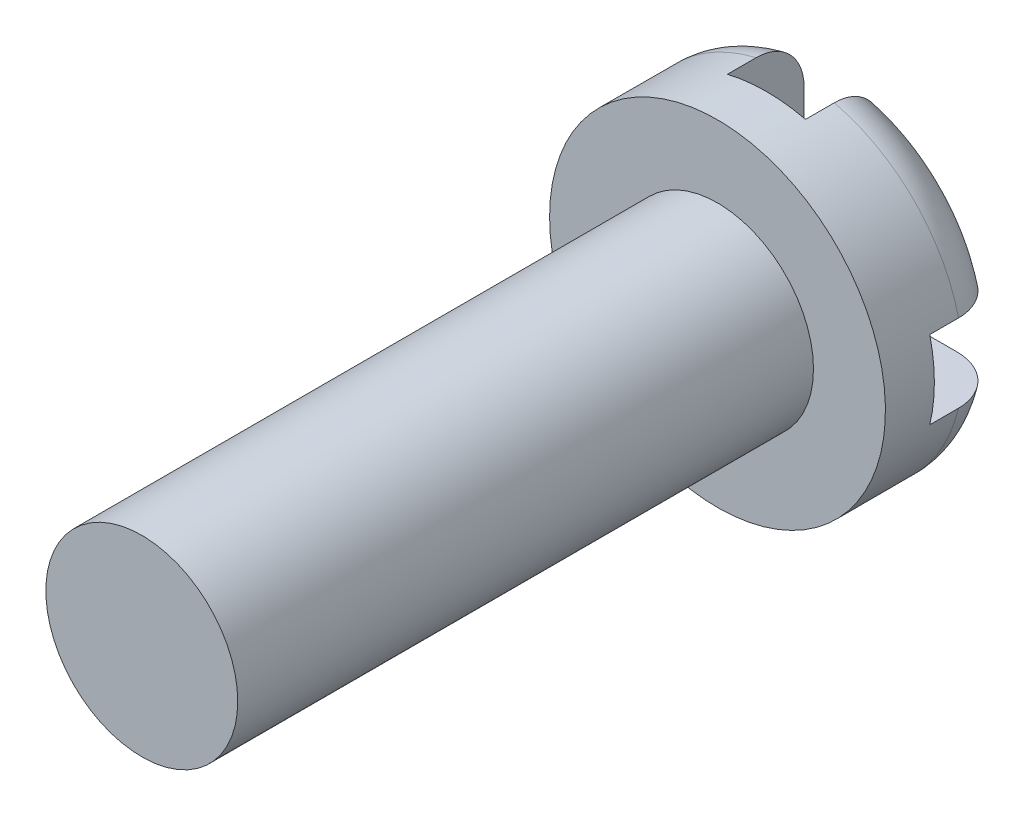
from build123d import *

# Parameters (mm, degrees)
SKETCH_1_R          = 1
EXTRUDE_1_DEPTH     = 6
SKETCH_2_R          = 1.75
EXTRUDE_2_DEPTH     = 1.31
FILLET_1_R          = 0.5
CUT_EXTRUDE_1_DEPTH = 0.8


with BuildPart() as part:
    # 草图1 → 凸台-拉伸1 (new body)
    with BuildSketch(Plane.XY):
        Circle(SKETCH_1_R)
    extrude(amount=EXTRUDE_1_DEPTH)

    # 草图2 → 凸台-拉伸2 (add)
    with BuildSketch(Plane(origin=(0, 0, 0), x_dir=(-1, 0, 0), z_dir=(0, 0, -1))):
        Circle(SKETCH_2_R)
    extrude(amount=EXTRUDE_2_DEPTH)

    # 圆角1
    fillet_1_edges = [part.edges().sort_by_distance(p)[0] for p in [
        (1.75, 0, -1.31),
    ]]
    fillet(fillet_1_edges, radius=FILLET_1_R)

    # 草图3 → 切除-拉伸1 (cut)
    with BuildSketch(Plane(origin=(0, 0, -1.31), x_dir=(-1, 0, 0), z_dir=(0, 0, -1))):
        Polygon((0.407106781, 0.407106781), (0.407106781, 5.706401657), (-0.407106781, 5.706401657), (-0.407106781, 0.407106781), (-5.706401657, 0.407106781), (-5.706401657, -0.407106781), (-0.407106781, -0.407106781), (-0.407106781, -5.706401657), (0.407106781, -5.706401657), (0.407106781, -0.407106781), (5.706401657, -0.407106781), (5.706401657, 0.407106781), align=None)
    extrude(amount=-CUT_EXTRUDE_1_DEPTH, mode=Mode.SUBTRACT)


solid = part.part
